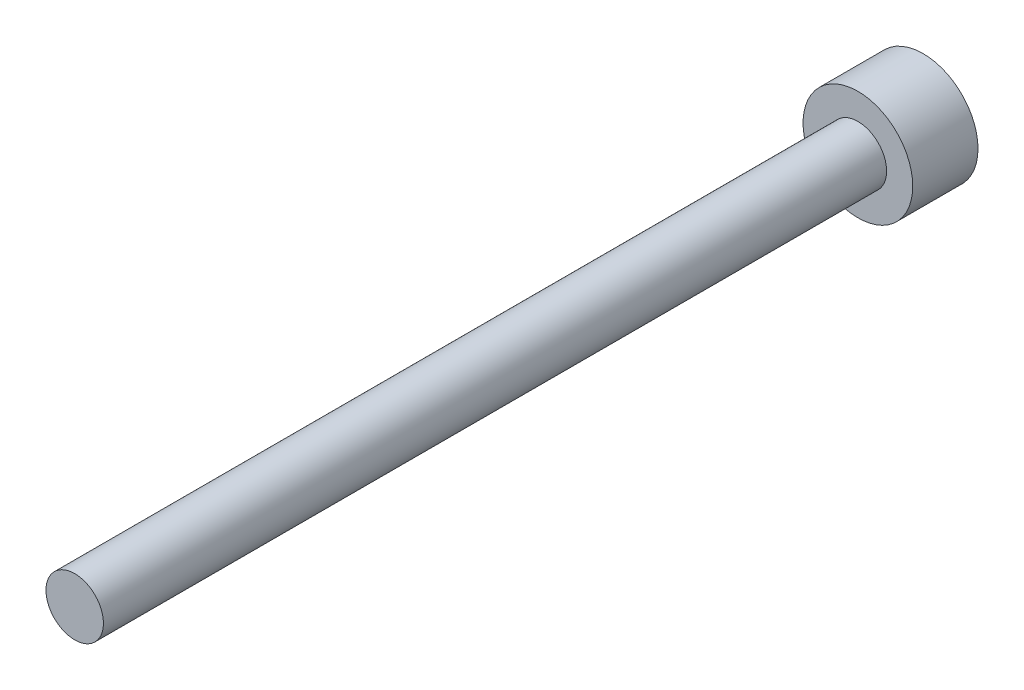
from build123d import *

# Parameters (mm, degrees)
SKETCH1_R           = 5.334
BOSS_EXTRUDE1_DEPTH = 6.35
SKETCH3_R           = 2.794
BOSS_EXTRUDE2_DEPTH = 76.2


with BuildPart() as part:
    # Sketch1 → Boss-Extrude1 (new body)
    with BuildSketch(Plane.XY):
        Circle(SKETCH1_R)
    extrude(amount=BOSS_EXTRUDE1_DEPTH)

    # Sketch3 → Boss-Extrude2 (add)
    with BuildSketch(Plane.XY.offset(6.35)):
        with Locations(Location((0, 0, 0), (0, 0, 180))):
            Circle(SKETCH3_R)
    extrude(amount=BOSS_EXTRUDE2_DEPTH)


solid = part.part
